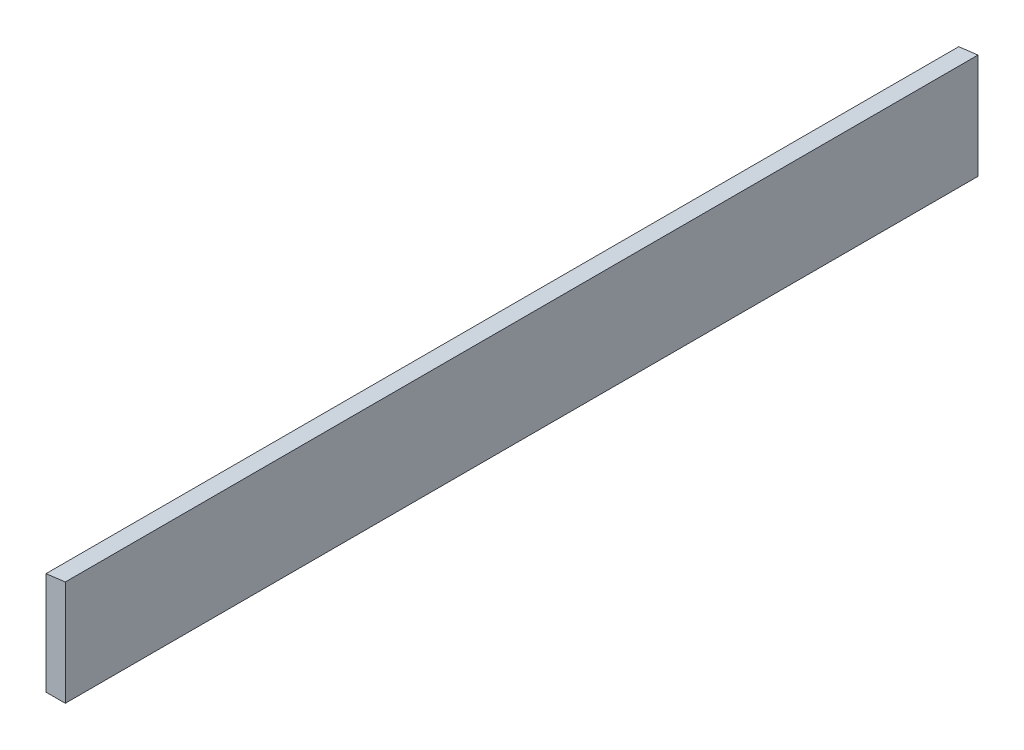
from build123d import *

# Parameters (mm, degrees)
BOSS_EXTRUDE1_DEPTH = 901.7


with BuildPart() as part:
    # Sketch1 → Boss-Extrude1 (new body)
    with BuildSketch(Plane.XY):
        Polygon((232.786295427, 128.625331568), (232.786295427, 27.19467147), (251.836295427, 27.19467147), (251.836295427, 131.008148634), align=None)
    extrude(amount=BOSS_EXTRUDE1_DEPTH)


solid = part.part
